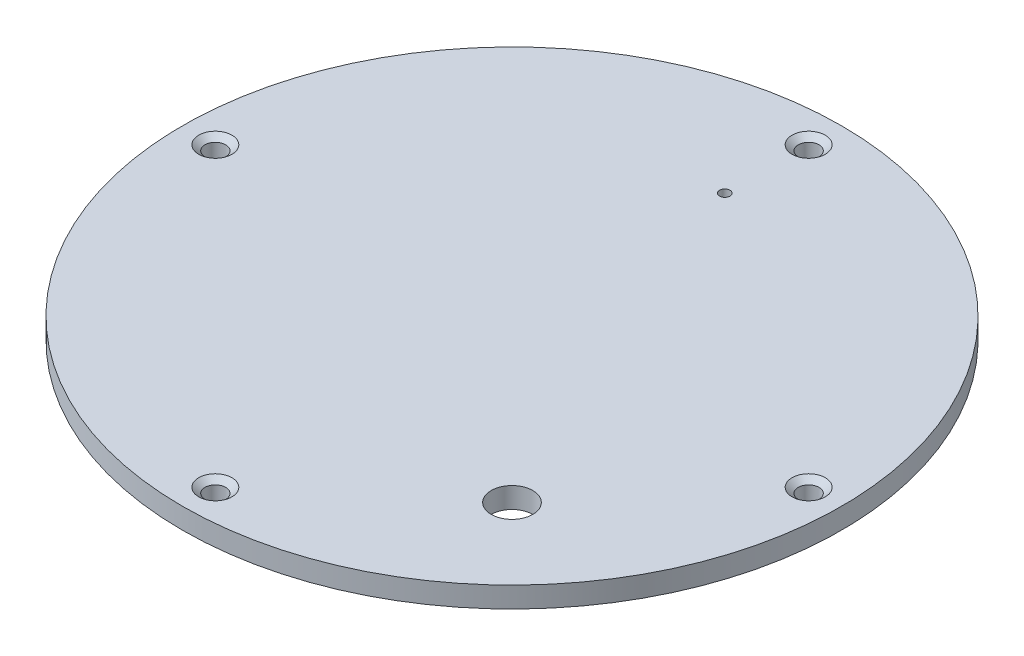
from build123d import *

# Parameters (mm, degrees)
SKETCH1_R                                       = 15.875
BOSS_EXTRUDE1_DEPTH                             = 1
CUT_EXTRUDE1_DEPTH                              = 23.472900347
CUT_EXTRUDE1_DEPTH_BACK                         = 23.472900347
SKETCH6_R                                       = 0.25
SKETCH6_R_2                                     = 1
CSK_FOR_M2_FLAT_HEAD_MACHINE_SCREW1_D           = 1
CSK_FOR_M2_FLAT_HEAD_MACHINE_SCREW1_CSINK_D     = 1.6
CSK_FOR_M2_FLAT_HEAD_MACHINE_SCREW1_CSINK_ANGLE = 100


with BuildPart() as part:
    # Sketch1 → Boss-Extrude1 (new body)
    with BuildSketch(Plane(origin=(0, 0, 0), x_dir=(1, 0, 0), z_dir=(0, 1, 0))):
        with Locations(Location((0, 0, 0), (0, 0, 270))):
            Circle(SKETCH1_R)
    extrude(amount=BOSS_EXTRUDE1_DEPTH)

    # Sketch6 → Cut-Extrude1 (cut, two sides: drawn at the far end of the back side and taken through both)
    with BuildSketch(Plane(origin=(0, 1, 0), x_dir=(1, 0, 0), z_dir=(0, 1, 0)).offset(-CUT_EXTRUDE1_DEPTH_BACK)):
        with Locations(Location((0, 10.25, 0), (0, 0, 270))):
            Circle(SKETCH6_R)
        with Locations(Location((7.778174593, -7.778174593, 0), (0, 0, 270))):
            Circle(SKETCH6_R_2)
    extrude(amount=CUT_EXTRUDE1_DEPTH + CUT_EXTRUDE1_DEPTH_BACK, mode=Mode.SUBTRACT)

    # CSK for M2 Flat Head Machine Screw1 (through all)
    with Locations(Plane(origin=(0, 1, 0), x_dir=(1, 0, 0), z_dir=(0, 1, 0))):
        with Locations((0, 14.29), (-14.29, 0), (0, -14.29), (14.29, 0)):
            CounterSinkHole(CSK_FOR_M2_FLAT_HEAD_MACHINE_SCREW1_D / 2, CSK_FOR_M2_FLAT_HEAD_MACHINE_SCREW1_CSINK_D / 2, counter_sink_angle=CSK_FOR_M2_FLAT_HEAD_MACHINE_SCREW1_CSINK_ANGLE)


solid = part.part
